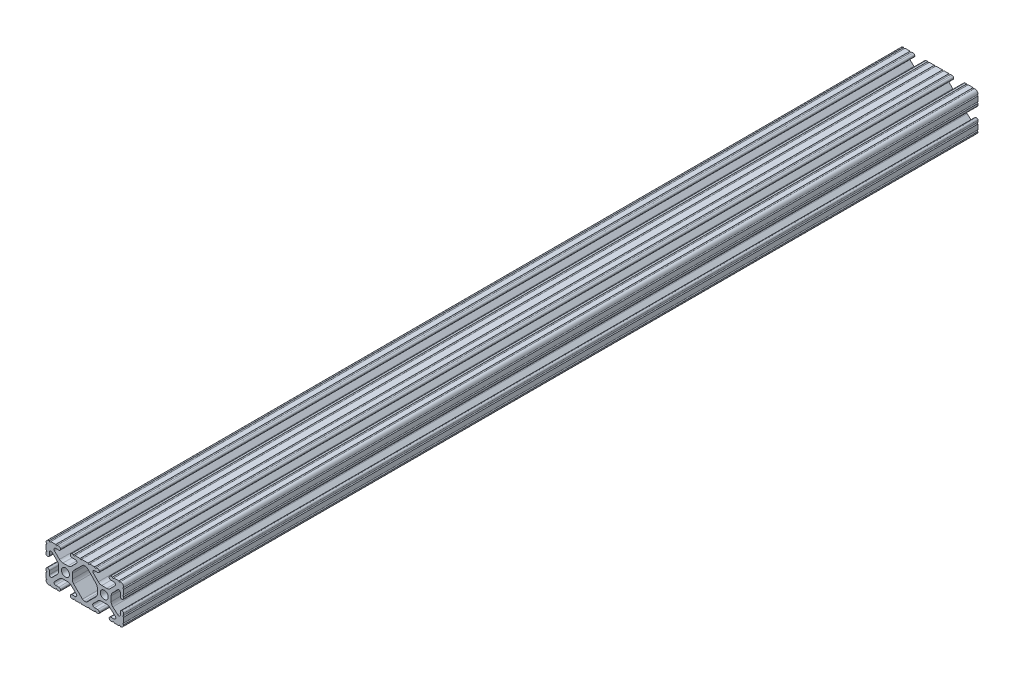
from build123d import *

# Parameters (mm, degrees)
SKETCH1_R               = 2.6035
BOSS_EXTRUDE1_DEPTH     = 279.4
CUT_EXTRUDE1_DEPTH      = 282.078664323
CUT_EXTRUDE1_DEPTH_BACK = 282.078664323
SKETCH2_R               = 3.175


with BuildPart() as part:
    # Sketch1 → Boss-Extrude1 (new, symmetric)
    with BuildSketch(Plane.XY):
        with BuildLine():
            Line((18.01710265, 12.7), (16.98745015, 12.7))
            ThreePointArc((16.98745015, 12.7), (16.245730386, 12.392769614), (15.9385, 11.65104985))
            Line((15.9385, 11.65104985), (15.9385, 11.53922))
            ThreePointArc((15.9385, 11.53922), (16.245750844, 10.797450844), (16.98752, 10.4902))
            Line((16.98752, 10.4902), (19.116384363, 10.4902))
            ThreePointArc((19.116384363, 10.4902), (20.052502933, 9.869096983), (19.844087081, 8.765172272))
            Line((19.844087081, 8.765172272), (16.618993479, 5.455112286))
            ThreePointArc((16.618993479, 5.455112286), (15.578994274, 4.745442459), (14.344932584, 4.4958))
            Line((14.344932584, 4.4958), (11.083317835, 4.4958))
            ThreePointArc((11.083317835, 4.4958), (9.854330953, 4.743306833), (8.816955189, 5.447238587))
            Line((8.816955189, 5.447238587), (5.564154119, 8.762652677))
            ThreePointArc((5.564154119, 8.762652677), (5.352591412, 9.867473037), (6.289393385, 10.4902))
            Line((6.289393385, 10.4902), (8.41248, 10.4902))
            ThreePointArc((8.41248, 10.4902), (9.154249156, 10.797450844), (9.4615, 11.53922))
            Line((9.4615, 11.53922), (9.4615, 11.65104985))
            ThreePointArc((9.4615, 11.65104985), (9.154269614, 12.392769614), (8.41254985, 12.7))
            Line((8.41254985, 12.7), (7.38288465, 12.7))
            ThreePointArc((7.38288465, 12.7), (6.87488465, 12.192), (6.36688465, 12.7))
            Line((6.36688465, 12.7), (3.14958095, 12.7))
            ThreePointArc((3.14958095, 12.7), (2.64158095, 12.192), (2.13358095, 12.7))
            Line((2.13358095, 12.7), (-2.13358095, 12.7))
            ThreePointArc((-2.13358095, 12.7), (-2.64158095, 12.192), (-3.14958095, 12.7))
            Line((-3.14958095, 12.7), (-6.36689735, 12.7))
            ThreePointArc((-6.36689735, 12.7), (-6.87489735, 12.192), (-7.38289735, 12.7))
            Line((-7.38289735, 12.7), (-8.41254985, 12.7))
            ThreePointArc((-8.41254985, 12.7), (-9.154269614, 12.392769614), (-9.4615, 11.65104985))
            Line((-9.4615, 11.65104985), (-9.4615, 11.53922))
            ThreePointArc((-9.4615, 11.53922), (-9.154249156, 10.797450844), (-8.41248, 10.4902))
            Line((-8.41248, 10.4902), (-6.283641037, 10.4902))
            ThreePointArc((-6.283641037, 10.4902), (-5.297291557, 9.829633109), (-5.532576693, 8.666071843))
            Line((-5.532576693, 8.666071843), (-8.809985098, 5.416263103))
            ThreePointArc((-8.809985098, 5.416263103), (-9.836720513, 4.734920264), (-11.045536121, 4.4958))
            Line((-11.045536121, 4.4958), (-14.354463879, 4.4958))
            ThreePointArc((-14.354463879, 4.4958), (-15.563279487, 4.734920264), (-16.590014902, 5.416263103))
            Line((-16.590014902, 5.416263103), (-19.867423307, 8.666071843))
            ThreePointArc((-19.867423307, 8.666071843), (-20.102708443, 9.829633109), (-19.116358963, 10.4902))
            Line((-19.116358963, 10.4902), (-16.98752, 10.4902))
            ThreePointArc((-16.98752, 10.4902), (-16.245750844, 10.797450844), (-15.9385, 11.53922))
            Line((-15.9385, 11.53922), (-15.9385, 11.65104985))
            ThreePointArc((-15.9385, 11.65104985), (-16.245730386, 12.392769614), (-16.98745015, 12.7))
            Line((-16.98745015, 12.7), (-18.01711535, 12.7))
            ThreePointArc((-18.01711535, 12.7), (-18.52511535, 12.192), (-19.03311535, 12.7))
            Line((-19.03311535, 12.7), (-22.2504, 12.7))
            ThreePointArc((-22.2504, 12.7), (-22.758323491, 12.192000006), (-23.266399977, 12.699846982))
            ThreePointArc((-23.266399977, 12.699846982), (-24.782522516, 12.082522516), (-25.399846982, 10.566399977))
            ThreePointArc((-25.399846982, 10.566399977), (-24.892000006, 10.058323491), (-25.4, 9.5504))
            Line((-25.4, 9.5504), (-25.4, 6.3330836))
            ThreePointArc((-25.4, 6.3330836), (-24.892, 5.8250836), (-25.4, 5.3170836))
            Line((-25.4, 5.3170836), (-25.4, 4.237520184))
            ThreePointArc((-25.4, 4.237520184), (-25.107393763, 3.531106237), (-24.400979816, 3.2385))
            Line((-24.400979816, 3.2385), (-24.23922, 3.2385))
            ThreePointArc((-24.23922, 3.2385), (-23.497450844, 3.545750844), (-23.1902, 4.28752))
            Line((-23.1902, 4.28752), (-23.1902, 6.334741132))
            ThreePointArc((-23.1902, 6.334741132), (-22.556026952, 7.286023527), (-21.434002553, 7.066535717))
            Line((-21.434002553, 7.066535717), (-18.147950853, 3.808156468))
            ThreePointArc((-18.147950853, 3.808156468), (-17.452759693, 2.774838327), (-17.208501877, 1.553619571))
            Line((-17.208501877, 1.553619571), (-17.208501877, -1.695179196))
            ThreePointArc((-17.208501877, -1.695179196), (-17.450738657, -2.911536421), (-18.140486065, -3.942289578))
            Line((-18.140486065, -3.942289578), (-21.431579576, -7.227386226))
            ThreePointArc((-21.431579576, -7.227386226), (-22.55444896, -7.449940594), (-23.1902, -6.498002195))
            Line((-23.1902, -6.498002195), (-23.1902, -4.28752))
            ThreePointArc((-23.1902, -4.28752), (-23.497450844, -3.545750844), (-24.23922, -3.2385))
            Line((-24.23922, -3.2385), (-24.35098, -3.2385))
            ThreePointArc((-24.35098, -3.2385), (-25.092749156, -3.545750844), (-25.4, -4.28752))
            Line((-25.4, -4.28752), (-25.4, -5.3171344))
            ThreePointArc((-25.4, -5.3171344), (-24.892, -5.8251344), (-25.4, -6.3331344))
            Line((-25.4, -6.3331344), (-25.4, -9.5504))
            ThreePointArc((-25.4, -9.5504), (-24.892000006, -10.058323491), (-25.399846982, -10.566399977))
            ThreePointArc((-25.399846982, -10.566399977), (-24.782522516, -12.082522516), (-23.266399977, -12.699846982))
            ThreePointArc((-23.266399977, -12.699846982), (-22.758323491, -12.192000006), (-22.2504, -12.7))
            Line((-22.2504, -12.7), (-19.03308995, -12.7))
            ThreePointArc((-19.03308995, -12.7), (-18.52508995, -12.192), (-18.01708995, -12.7))
            Line((-18.01708995, -12.7), (-16.9874692, -12.7))
            ThreePointArc((-16.9874692, -12.7), (-16.245700044, -12.392749156), (-15.9384492, -11.65098))
            Line((-15.9384492, -11.65098), (-15.9384492, -11.53922))
            ThreePointArc((-15.9384492, -11.53922), (-16.245700044, -10.797450844), (-16.9874692, -10.4902))
            Line((-16.9874692, -10.4902), (-19.116358963, -10.4902))
            ThreePointArc((-19.116358963, -10.4902), (-20.055197748, -9.862578342), (-19.834124023, -8.755124678))
            Line((-19.834124023, -8.755124678), (-16.49660751, -5.423689618))
            ThreePointArc((-16.49660751, -5.423689618), (-15.467274017, -4.736928798), (-14.253591699, -4.4958))
            Line((-14.253591699, -4.4958), (-11.146408301, -4.4958))
            ThreePointArc((-11.146408301, -4.4958), (-9.932725983, -4.736928798), (-8.90339249, -5.423689618))
            Line((-8.90339249, -5.423689618), (-5.565875977, -8.755124678))
            ThreePointArc((-5.565875977, -8.755124678), (-5.344802252, -9.862578342), (-6.283641037, -10.4902))
            Line((-6.283641037, -10.4902), (-8.4125308, -10.4902))
            ThreePointArc((-8.4125308, -10.4902), (-9.154299956, -10.797450844), (-9.4615508, -11.53922))
            Line((-9.4615508, -11.53922), (-9.4615508, -11.65098))
            ThreePointArc((-9.4615508, -11.65098), (-9.154299956, -12.392749156), (-8.4125308, -12.7))
            Line((-8.4125308, -12.7), (-7.38287195, -12.7))
            ThreePointArc((-7.38287195, -12.7), (-6.87487195, -12.192), (-6.36687195, -12.7))
            Line((-6.36687195, -12.7), (-3.14960635, -12.7))
            ThreePointArc((-3.14960635, -12.7), (-2.64160635, -12.192), (-2.13360635, -12.7))
            Line((-2.13360635, -12.7), (2.13360635, -12.7))
            ThreePointArc((2.13360635, -12.7), (2.64159365, -12.1920127), (3.14958095, -12.7))
            Line((3.14958095, -12.7), (6.36691005, -12.7))
            ThreePointArc((6.36691005, -12.7), (6.87491005, -12.192), (7.38291005, -12.7))
            Line((7.38291005, -12.7), (8.4125308, -12.7))
            ThreePointArc((8.4125308, -12.7), (9.154299956, -12.392749156), (9.4615508, -11.65098))
            Line((9.4615508, -11.65098), (9.4615508, -11.53922))
            ThreePointArc((9.4615508, -11.53922), (9.154299956, -10.797450844), (8.4125308, -10.4902))
            Line((8.4125308, -10.4902), (6.289393385, -10.4902))
            ThreePointArc((6.289393385, -10.4902), (5.231590322, -9.783049717), (5.480677245, -8.535265862))
            Line((5.480677245, -8.535265862), (8.597933595, -5.423689618))
            ThreePointArc((8.597933595, -5.423689618), (9.627267088, -4.736928798), (10.840949406, -4.4958))
            Line((10.840949406, -4.4958), (14.102564155, -4.4958))
            ThreePointArc((14.102564155, -4.4958), (15.215927525, -4.697410182), (16.187895372, -5.276636531))
            Line((16.187895372, -5.276636531), (19.868247549, -8.482246082))
            ThreePointArc((19.868247549, -8.482246082), (20.188435806, -9.746879864), (19.116384363, -10.4902))
            Line((19.116384363, -10.4902), (16.9874692, -10.4902))
            ThreePointArc((16.9874692, -10.4902), (16.245700044, -10.797450844), (15.9384492, -11.53922))
            Line((15.9384492, -11.53922), (15.9384492, -11.65098))
            ThreePointArc((15.9384492, -11.65098), (16.245700044, -12.392749156), (16.9874692, -12.7))
            Line((16.9874692, -12.7), (18.01710265, -12.7))
            ThreePointArc((18.01710265, -12.7), (18.52510265, -12.192), (19.03310265, -12.7))
            Line((19.03310265, -12.7), (22.2504, -12.7))
            ThreePointArc((22.2504, -12.7), (22.758323491, -12.192000006), (23.266399977, -12.699846982))
            ThreePointArc((23.266399977, -12.699846982), (24.782522516, -12.082522516), (25.399846982, -10.566399977))
            ThreePointArc((25.399846982, -10.566399977), (24.892000006, -10.058323492), (25.4, -9.550400001))
            Line((25.4, -9.550400001), (25.4, -6.333083592))
            ThreePointArc((25.4, -6.333083592), (24.892000001, -5.825083593), (25.4, -5.317083593))
            Line((25.4, -5.317083593), (25.4, -4.237520184))
            ThreePointArc((25.4, -4.237520184), (25.107393763, -3.531106237), (24.400979816, -3.2385))
            Line((24.400979816, -3.2385), (24.189220184, -3.2385))
            ThreePointArc((24.189220184, -3.2385), (23.482806237, -3.531106237), (23.1902, -4.237520184))
            Line((23.1902, -4.237520184), (23.1902, -6.155876159))
            ThreePointArc((23.1902, -6.155876159), (22.62232736, -7.038258539), (21.583974541, -6.886926384))
            Line((21.583974541, -6.886926384), (18.29817066, -4.024970844))
            ThreePointArc((18.29817066, -4.024970844), (17.493730985, -2.946044689), (17.208501877, -1.630807374))
            Line((17.208501877, -1.630807374), (17.208501877, 1.630807374))
            ThreePointArc((17.208501877, 1.630807374), (17.442348332, 2.82673414), (18.109440981, 3.846495088))
            Line((18.109440981, 3.846495088), (21.526346532, 7.353420386))
            ThreePointArc((21.526346532, 7.353420386), (22.585896263, 7.574939077), (23.1902, 6.676867167))
            Line((23.1902, 6.676867167), (23.1902, 4.237520184))
            ThreePointArc((23.1902, 4.237520184), (23.482806237, 3.531106237), (24.189220184, 3.2385))
            Line((24.189220184, 3.2385), (24.400979816, 3.2385))
            ThreePointArc((24.400979816, 3.2385), (25.107393763, 3.531106237), (25.4, 4.237520184))
            Line((25.4, 4.237520184), (25.4, 5.3170836))
            ThreePointArc((25.4, 5.3170836), (24.891949193, 5.825134407), (25.4, 6.333185215))
            Line((25.4, 6.333185215), (25.4, 9.550400015))
            ThreePointArc((25.4, 9.550400015), (24.892000013, 10.058323498), (25.399846982, 10.566399977))
            ThreePointArc((25.399846982, 10.566399977), (24.782522516, 12.082522516), (23.266399977, 12.699846982))
            ThreePointArc((23.266399977, 12.699846982), (22.758323491, 12.192000006), (22.2504, 12.7))
            Line((22.2504, 12.7), (19.03310265, 12.7))
            ThreePointArc((19.03310265, 12.7), (18.52510265, 12.192), (18.01710265, 12.7))
        make_face()
        with Locations((-12.7, 0)):
            Circle(SKETCH1_R, mode=Mode.SUBTRACT)
        with Locations((12.7, 0)):
            Circle(SKETCH1_R, mode=Mode.SUBTRACT)
        with BuildLine():
            Line((-7.259513935, -3.869413038), (-1.545748891, -9.572766749))
            ThreePointArc((-1.545748891, -9.572766749), (-1.035199478, -9.913400116), (-0.433213048, -10.033))
            Line((-0.433213048, -10.033), (0.433213048, -10.033))
            ThreePointArc((0.433213048, -10.033), (1.035199478, -9.913400116), (1.545748891, -9.572766749))
            Line((1.545748891, -9.572766749), (7.259513935, -3.869413038))
            ThreePointArc((7.259513935, -3.869413038), (7.949261343, -2.838659881), (8.191498123, -1.622302656))
            Line((8.191498123, -1.622302656), (8.191498123, 1.622302656))
            ThreePointArc((8.191498123, 1.622302656), (7.955573352, 2.823327967), (7.282860769, 3.845864069))
            Line((7.282860769, 3.845864069), (1.675572808, 9.561086461))
            ThreePointArc((1.675572808, 9.561086461), (1.161034429, 9.910236611), (0.551456936, 10.033))
            Line((0.551456936, 10.033), (-0.395199982, 10.033))
            ThreePointArc((-0.395199982, 10.033), (-0.994772524, 9.914396349), (-1.50403329, 9.576450301))
            Line((-1.50403329, 9.576450301), (-7.252049147, 3.876839553))
            ThreePointArc((-7.252049147, 3.876839553), (-7.947240307, 2.843521412), (-8.191498123, 1.622302656))
            Line((-8.191498123, 1.622302656), (-8.191498123, -1.622302656))
            ThreePointArc((-8.191498123, -1.622302656), (-7.949261343, -2.838659881), (-7.259513935, -3.869413038))
        make_face(mode=Mode.SUBTRACT)
    extrude(amount=BOSS_EXTRUDE1_DEPTH, both=True)

    # Sketch2 → Cut-Extrude1 (cut, two sides: drawn at the far end of the back side and taken through both)
    with BuildSketch(Plane(origin=(0, 4.4958, 0), x_dir=(1, 0, 0), z_dir=(0, 1, 0)).offset(-CUT_EXTRUDE1_DEPTH_BACK)):
        with Locations(Location((-12.7, -254, 0), (0, 0, 121.405461147))):
            Circle(SKETCH2_R)
        with Locations(Location((-12.7, 254, 0), (0, 0, 121.405461147))):
            Circle(SKETCH2_R)
        with Locations(Location((12.7, 254, 0), (0, 0, 234.159718384))):
            Circle(SKETCH2_R)
        with Locations(Location((12.7, -254, 0), (0, 0, 234.159718384))):
            Circle(SKETCH2_R)
    extrude(amount=CUT_EXTRUDE1_DEPTH + CUT_EXTRUDE1_DEPTH_BACK, mode=Mode.SUBTRACT)


solid = part.part
